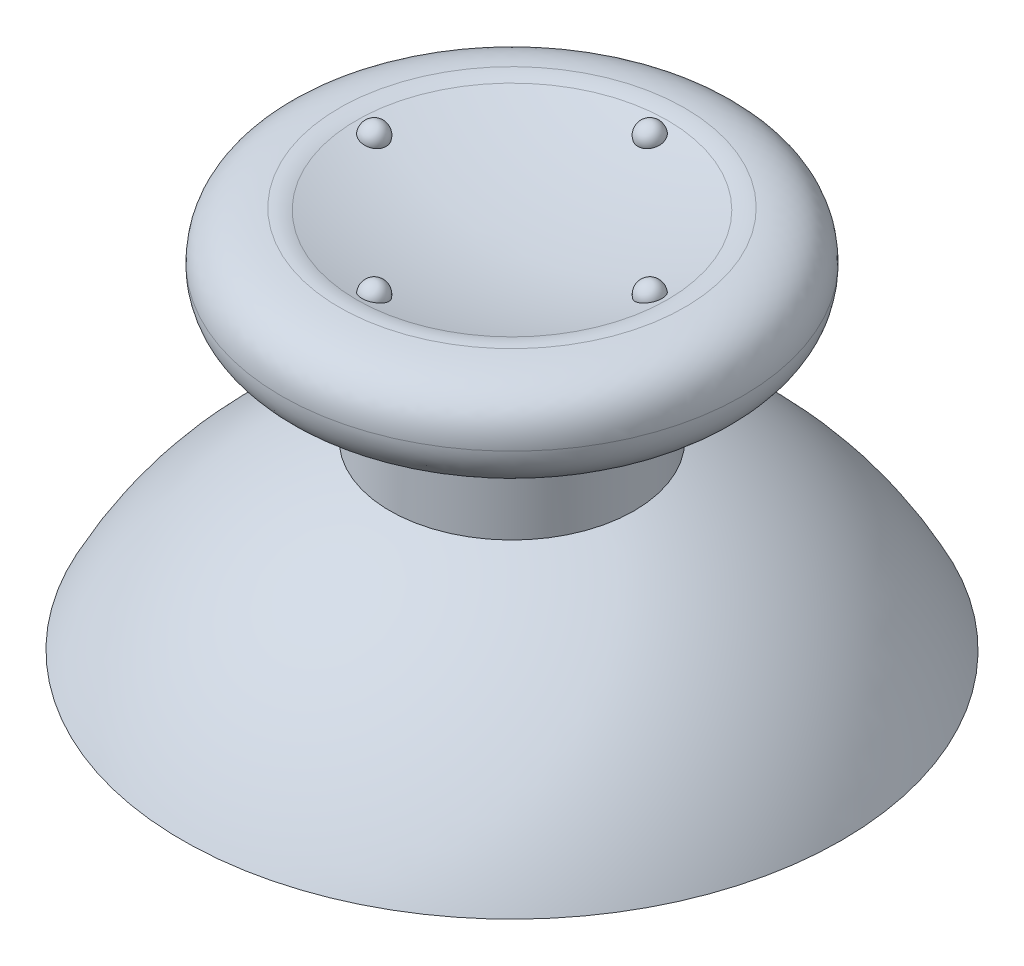
from build123d import *

# Parameters (mm, degrees)
FILLET1_R         = 2
CIRPATTERN1_COUNT = 4
SKETCH7_R         = 2.75
EXTRUDE4_DEPTH    = 5.592663071
CHAMFER7_SIZE     = 0.5
CHAMFER7_SIZE2    = 0.288675135
EXTRUDE1_DEPTH    = 1
EXTRUDE2_DEPTH    = 0.375
CIRPATTERN2_COUNT = 2
CIRPATTERN2_ANGLE = 90
CHAMFER8_SIZE     = 0.3
EXTRUDE5_DEPTH    = 4.5
SKETCH10_R        = 0.75
EXTRUDE6_DEPTH    = 1.5


with BuildPart() as part:
    # Sketch1 → Revolve1 (revolve)
    with BuildSketch(Plane.XY):
        with BuildLine():
            Line((4.875, 7.25), (4.875, 11.15))
            add(Edge.make_bspline(
                [(4.875, 11.15), (9.2, 11.15), (9.2, 13.37879152)],
                knots=[0, 0, 0, 1, 1, 1], degree=2))
            add(Edge.make_bspline(
                [(6.5, 15.3), (9.2, 15.3), (9.2, 13.37879152)],
                knots=[0, 0, 0, 1, 1, 1], degree=2))
            ThreePointArc((6.5, 15.3), (3.288236609, 14.551462038), (0, 14.3))
            Line((0, 14.3), (0, 6.592663071))
            Line((0, 6.592663071), (3.625, 6.592663071))
            ThreePointArc((3.625, 6.592663071), (8.487888372, 4.14452152), (12.018330519, 0))
            Line((12.018330519, 0), (13.15, 0))
            ThreePointArc((13.15, 0), (9.714205127, 4.425911714), (4.875, 7.25))
        make_face()
    revolve(axis=Axis((0, 4.818084651, 0), (0, 1, 0)))

    # Fillet1
    fillet1_edges = [part.edges().sort_by_distance(p)[0] for p in [
        (-6.5, 15.3, 0),
    ]]
    fillet(fillet1_edges, radius=FILLET1_R)

    # Sketch2 → Revolve2 (revolve)
    with BuildSketch(Plane.XY):
        with BuildLine():
            Line((5, 15.042457163), (6, 15.042457163))
            ThreePointArc((6, 15.042457163), (5.5, 15.542457163), (5, 15.042457163))
        make_face()
    revolve2 = revolve(axis=Axis((5, 15.042457163, 0), (1, 0, 0)))

    # CirPattern1: Revolve2 ×4 about axis
    cirpattern1_axis = Axis((0, 0, 0), (0, 1, 0))
    for i in range(1, CIRPATTERN1_COUNT):
        add(revolve2.rotate(cirpattern1_axis, i * 360 / CIRPATTERN1_COUNT))

    # Sketch7 → Extrude4 (add)
    with BuildSketch(Plane.XZ.offset(-6.592663071)):
        with Locations(Location((0, 0, 0), (0, 0, 270))):
            Circle(SKETCH7_R)
    extrude(amount=EXTRUDE4_DEPTH)

    # Chamfer7
    chamfer7_edges = [part.edges().sort_by_distance(p)[0] for p in [
        (0, 1, 2.75),
    ]]
    chamfer7_side = [part.faces().sort_by_distance(p)[0] for p in [
        (0, 1, 0),
    ]]
    chamfer(chamfer7_edges, length=CHAMFER7_SIZE, length2=CHAMFER7_SIZE2, reference=chamfer7_side[0])

    # Sketch4 → Extrude1 (add, symmetric)
    with BuildSketch(Plane(origin=(0, 0, 0), x_dir=(-0.7071067811865462, 0, -0.7071067811865488), z_dir=(0.7071067811865488, 0, -0.7071067811865462))):
        with BuildLine():
            Line((-5.5, 5.930708042), (-5.5, 2.488594961))
            Line((-5.5, 2.488594961), (-2.379095763, 1))
            Line((-2.379095763, 1), (2.379095763, 1))
            Line((2.379095763, 1), (5.5, 2.488594961))
            Line((5.5, 2.488594961), (5.5, 5.930708042))
            ThreePointArc((5.5, 5.930708042), (4.574489301, 6.295645476), (3.625, 6.592663071))
            Line((3.625, 6.592663071), (-3.625, 6.592663071))
            ThreePointArc((-3.625, 6.592663071), (-4.574489301, 6.295645476), (-5.5, 5.930708042))
        make_face()
    extrude1 = extrude(amount=EXTRUDE1_DEPTH, both=True)

    # Sketch5 → Extrude2 (add, symmetric)
    with BuildSketch(Plane(origin=(0, 0, 0), x_dir=(0.7071067811865462, 0, 0.7071067811865488), z_dir=(-0.7071067811865488, 0, 0.7071067811865462))):
        with BuildLine():
            Line((-5.5, 2.488594961), (-8.66872656, 4))
            ThreePointArc((-8.66872656, 4), (-7.149832968, 5.072804518), (-5.5, 5.930708042))
            Line((-5.5, 5.930708042), (-5.5, 2.488594961))
        make_face()
        with BuildLine():
            Line((5.5, 2.488594961), (8.66872656, 4))
            ThreePointArc((8.66872656, 4), (7.149832968, 5.072804518), (5.5, 5.930708042))
            Line((5.5, 5.930708042), (5.5, 2.488594961))
        make_face()
    extrude2 = extrude(amount=EXTRUDE2_DEPTH, both=True)

    # CirPattern2: Extrude1, Extrude2 ×2 about axis
    cirpattern2_axis = Axis((0, 0, 0), (0, -1, 0))
    add([extrude1.rotate(cirpattern2_axis, i * CIRPATTERN2_ANGLE / (CIRPATTERN2_COUNT - 1)) for i in range(1, CIRPATTERN2_COUNT)])
    add([extrude2.rotate(cirpattern2_axis, i * CIRPATTERN2_ANGLE / (CIRPATTERN2_COUNT - 1)) for i in range(1, CIRPATTERN2_COUNT)])

    # Chamfer8
    chamfer8_edges = [part.edges().sort_by_distance(p)[0] for p in [
        (-1.682274747, 1, 1.682274747),
        (1.682274747, 1, -1.682274747),
        (1.682274747, 1, 1.682274747),
        (-1.682274747, 1, -1.682274747),
    ]]
    chamfer(chamfer8_edges, length=CHAMFER8_SIZE)

    # Sketch9 → Extrude5 (cut)
    with BuildSketch(Plane.XZ.offset(-1)):
        with BuildLine():
            Line((-1.452368755, 1.375), (-0.375, 1.375))
            ThreePointArc((-0.375, 1.375), (0, 1.544281086), (0.375, 1.375))
            Line((0.375, 1.375), (1.452368755, 1.375))
            ThreePointArc((1.452368755, 1.375), (2, 0), (1.452368755, -1.375))
            Line((1.452368755, -1.375), (-1.452368755, -1.375))
            ThreePointArc((-1.452368755, -1.375), (-2, 0), (-1.452368755, 1.375))
        make_face()
    extrude(amount=-EXTRUDE5_DEPTH, mode=Mode.SUBTRACT)

    # Sketch10 → Extrude6 (cut)
    with BuildSketch(Plane.XZ.offset(-5.5)):
        with Locations(Location((0, 0, 0), (0, 0, 270))):
            Circle(SKETCH10_R)
    extrude(amount=-EXTRUDE6_DEPTH, mode=Mode.SUBTRACT)


solid = part.part
